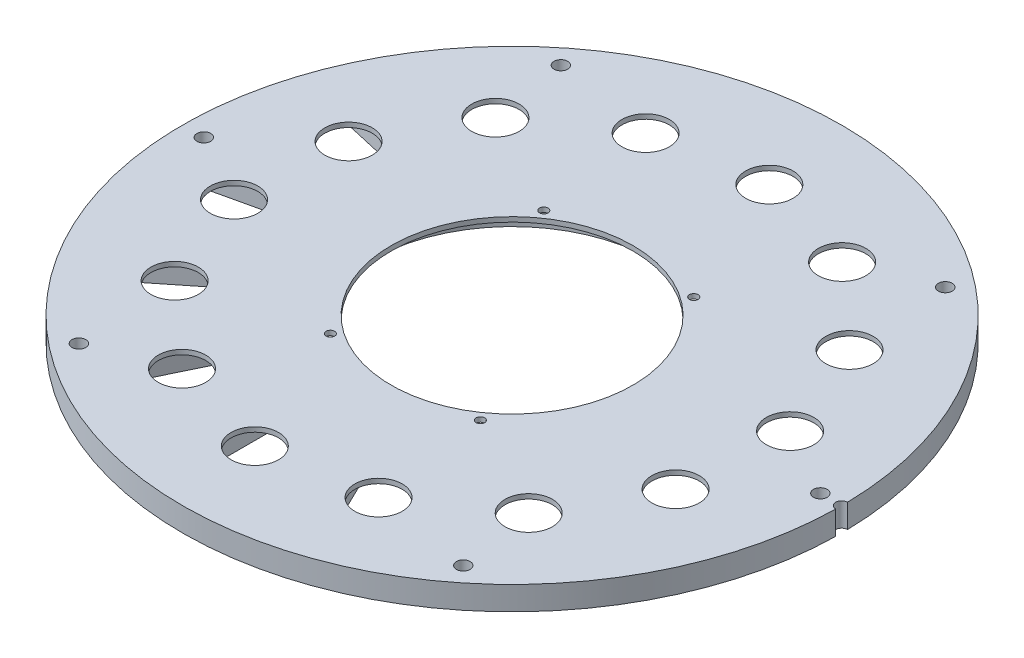
from build123d import *

# Parameters (mm, degrees)
SKETCH_1_R               = 139
EXTRUDE_1_DEPTH          = 10
CUT_EXTRUDE_572_DEPTH    = 8
PATTERN_CIRCULAR_1_COUNT = 14
SKETCH_3_R               = 51
CUT_EXTRUDE_921_DEPTH    = 197.829875781
SKETCH_5_R               = 10
CUT_EXTRUDE_1071_DEPTH   = 197.738404995
PATTERN_CIRCULAR_2_COUNT = 14
HOLE_WIZARD_M3_D         = 3.6
MIRROR_2_COPY_1_D        = 3.6
M5SUPPORTINGPOLE_D       = 5.8
M5_SUPPORTING_POLE_D     = 5.8
MIRROR_4_COPY_1_D        = 5.8
MIRROR_4_COPY_2_D        = 5.8
MIRROR_4_COPY_3_D        = 5.8
SKETCH_15_R              = 5.1
CUT_EXTRUDE_7_DEPTH      = 5
MIRROR_6_COPY_1_SKETCH_R = 5.1
MIRROR_6_COPY_1_DEPTH    = 5
SKETCH_16_R              = 60
SKETCH_16_R_2            = 51
CUT_EXTRUDE_8_DEPTH      = 8
SKETCH_18_R              = 2.5
CUT_EXTRUDE_10_DEPTH     = 197.829875781


with BuildPart() as part:
    # ｽｹｯﾁ1 → ﾎﾞｽ - 押し出し1 (new body)
    with BuildSketch(Plane(origin=(0, 0, 0), x_dir=(1, 0, 0), z_dir=(0, 1, 0))):
        with Locations(Location((0, 0, 0), (0, 0, 270))):
            Circle(SKETCH_1_R)
    extrude(amount=EXTRUDE_1_DEPTH)

    # ｽｹｯﾁ2 → Cut-Extrude 572 (cut)
    with BuildSketch(Plane.XZ):
        with BuildLine():
            Line((18.5, 119), (18.5, 85))
            ThreePointArc((18.5, 85), (0, 66.5), (-18.5, 85))
            Line((-18.5, 85), (-18.5, 119))
            ThreePointArc((-18.5, 119), (0, 137.5), (18.5, 119))
        make_face()
    cut_extrude_572 = extrude(amount=-CUT_EXTRUDE_572_DEPTH, mode=Mode.SUBTRACT)

    # 円形ﾊﾟﾀｰﾝ1: Cut-Extrude 572 ×14 about axis
    pattern_circular_1_axis = Axis((0, 0, 0), (0, 1, 0))
    for i in range(1, PATTERN_CIRCULAR_1_COUNT):
        add(cut_extrude_572.rotate(pattern_circular_1_axis, i * 360 / PATTERN_CIRCULAR_1_COUNT), mode=Mode.SUBTRACT)

    # ｽｹｯﾁ3 → Cut-Extrude 921 (cut, through all)
    with BuildSketch(Plane(origin=(0, 0, 0), x_dir=(-1, 0, 0), z_dir=(0, -1, 0))):
        with Locations(Location((0, 0, 0), (0, 0, 90))):
            Circle(SKETCH_3_R)
    extrude(amount=-CUT_EXTRUDE_921_DEPTH, mode=Mode.SUBTRACT)

    # ｽｹｯﾁ5 → Cut-Extrude 1071 (cut, through all)
    with BuildSketch(Plane.XZ.offset(-8)):
        with Locations(Location((-6.5, 102, 0), (0, 0, 270))):
            Circle(SKETCH_5_R)
    cut_extrude_1071 = extrude(amount=-CUT_EXTRUDE_1071_DEPTH, mode=Mode.SUBTRACT)

    # 円形ﾊﾟﾀｰﾝ2: Cut-Extrude 1071 ×14 about axis
    pattern_circular_2_axis = Axis((0, 0, 0), (0, 1, 0))
    for i in range(1, PATTERN_CIRCULAR_2_COUNT):
        add(cut_extrude_1071.rotate(pattern_circular_2_axis, i * 360 / PATTERN_CIRCULAR_2_COUNT), mode=Mode.SUBTRACT)

    # M3(六角スペーサ) キールへの固定穴 (through all)
    with Locations(Plane(origin=(-31.622776602, 10, -45), x_dir=(0, 0, 1), z_dir=(0, 1, 0))):
        with Locations((0, 0)):
            hole_wizard_m3 = Hole(HOLE_WIZARD_M3_D / 2)

    # ﾐﾗｰ1: M3(六角スペーサ) キールへの固定穴 across plane
    add(hole_wizard_m3.mirror(Plane.XY), mode=Mode.SUBTRACT)

    # ﾐﾗｰ2: M3(六角スペーサ) キールへの固定穴 across plane
    add(hole_wizard_m3.mirror(Plane(origin=(0, 0, 0), x_dir=(0, 0, 1), z_dir=(1, 0, 0))), mode=Mode.SUBTRACT)

    # ﾐﾗｰ2 copy 1 (through all)
    with Locations(Plane(origin=(31.622776602, 10, 45), x_dir=(0, 0, -1), z_dir=(0, 1, 0))):
        with Locations((0, 0)):
            Hole(MIRROR_2_COPY_1_D / 2)

    # M5supportingpole用 (through all)
    with Locations(Plane(origin=(130, 0, 0), x_dir=(0, 0, -1), z_dir=(0, -1, 0))):
        with Locations((0, 0)):
            m5supportingpole = Hole(M5SUPPORTINGPOLE_D / 2)

    # M5 supporting_pole用 (through all)
    with Locations(Plane(origin=(81.053674242, 0, 101.638092721), x_dir=(0, 0, -1), z_dir=(0, -1, 0))):
        with Locations((0, 0)):
            m5_supporting_pole = Hole(M5_SUPPORTING_POLE_D / 2)

    # ﾐﾗｰ3: M5supportingpole用, M5 supporting_pole用 across plane
    add(m5supportingpole.mirror(Plane.XY), mode=Mode.SUBTRACT)
    add(m5_supporting_pole.mirror(Plane.XY), mode=Mode.SUBTRACT)

    # ﾐﾗｰ4: M5 supporting_pole用 across plane
    add(m5_supporting_pole.mirror(Plane(origin=(0, 0, 0), x_dir=(0, 0, 1), z_dir=(1, 0, 0))), mode=Mode.SUBTRACT)

    # ﾐﾗｰ4 copy 1 (through all)
    with Locations(Plane(origin=(-130, 0, 0), x_dir=(0, 0, 1), z_dir=(0, -1, 0))):
        with Locations((0, 0)):
            Hole(MIRROR_4_COPY_1_D / 2)

    # ﾐﾗｰ4 copy 2 (through all)
    with Locations(Plane(origin=(-81.053674242, 0, -101.638092721), x_dir=(0, 0, 1), z_dir=(0, -1, 0))):
        with Locations((0, 0)):
            Hole(MIRROR_4_COPY_2_D / 2)

    # ﾐﾗｰ4 copy 3 (through all)
    with Locations(Plane(origin=(-130, 0, 0), x_dir=(0, 0, -1), z_dir=(0, -1, 0))):
        with Locations((0, 0)):
            Hole(MIRROR_4_COPY_3_D / 2)

    # ｽｹｯﾁ15 → ｶｯﾄ - 押し出し7 (cut)
    with BuildSketch(Plane.XZ):
        with Locations(Location((81.053674242, 101.638092721, 0), (0, 0, 270))):
            Circle(SKETCH_15_R)
        with Locations(Location((130, 0, 0), (0, 0, 270))):
            Circle(SKETCH_15_R)
    cut_extrude_7 = extrude(amount=-CUT_EXTRUDE_7_DEPTH, mode=Mode.SUBTRACT)

    # ﾐﾗｰ5: ｶｯﾄ - 押し出し7 across plane
    add(cut_extrude_7.mirror(Plane.XY), mode=Mode.SUBTRACT)

    # ﾐﾗｰ6: ｶｯﾄ - 押し出し7 across plane
    add(cut_extrude_7.mirror(Plane(origin=(0, 0, 0), x_dir=(0, 0, 1), z_dir=(1, 0, 0))), mode=Mode.SUBTRACT)

    # ﾐﾗｰ6 copy 1 sketch → ﾐﾗｰ6 copy 1 (cut)
    with BuildSketch(Plane(origin=(0, 0, 0), x_dir=(-1, 0, 0), z_dir=(0, -1, 0))):
        with Locations(Location((81.053674242, 101.638092721, 0), (0, 0, 270))):
            Circle(MIRROR_6_COPY_1_SKETCH_R)
        with Locations(Location((130, 0, 0), (0, 0, 270))):
            Circle(MIRROR_6_COPY_1_SKETCH_R)
    extrude(amount=-MIRROR_6_COPY_1_DEPTH, mode=Mode.SUBTRACT)

    # ｽｹｯﾁ16 → ｶｯﾄ - 押し出し8 (cut)
    with BuildSketch(Plane.XZ):
        with Locations(Location((0, 0, 0), (0, 0, 270))):
            Circle(SKETCH_16_R)
        with Locations(Location((0, 0, 0), (0, 0, 270))):
            Circle(SKETCH_16_R_2, mode=Mode.SUBTRACT)
    extrude(amount=-CUT_EXTRUDE_8_DEPTH, mode=Mode.SUBTRACT)

    # ｽｹｯﾁ18 → ｶｯﾄ - 押し出し10 (cut, through all)
    with BuildSketch(Plane(origin=(0, 10, 0), x_dir=(1, 0, 0), z_dir=(0, 1, 0))):
        with Locations((139, 0)):
            Circle(SKETCH_18_R)
    extrude(amount=-CUT_EXTRUDE_10_DEPTH, mode=Mode.SUBTRACT)


solid = part.part
